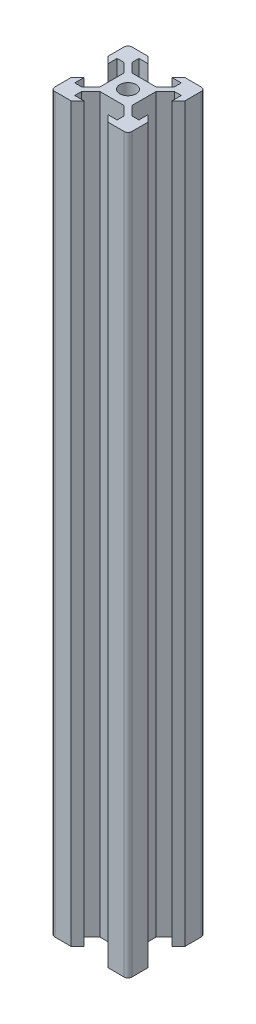
from build123d import *

# Parameters (mm, degrees)
MASTERLAYOUTSKETCH_R = 2.1
MAIN_EXTRUSION_DEPTH = 190
EDGE_FILLETS_R       = 1


with BuildPart() as part:
    # MasterLayoutSketch → Main Extrusion (new body)
    with BuildSketch(Plane(origin=(0, 0, 0), x_dir=(1, 0, 0), z_dir=(0, 1, 0))):
        Polygon((-8.325, 3.1), (-8.325, 5.5), (-6.560660172, 5.5), (-4.160660172, 3.1), (-4.160660172, -3.1), (-6.560660172, -5.5), (-8.325, -5.5), (-8.325, -3.1), (-10, -4.775), (-10, -10), (-4.775, -10), (-3.1, -8.325), (-5.5, -8.325), (-5.5, -6.560660172), (-3.1, -4.160660172), (3.1, -4.160660172), (5.5, -6.560660172), (5.5, -8.325), (3.1, -8.325), (4.775, -10), (10, -10), (10, -4.775), (8.325, -3.1), (8.325, -5.5), (6.560660172, -5.5), (4.160660172, -3.1), (4.160660172, 3.1), (6.560660172, 5.5), (8.325, 5.5), (8.325, 3.1), (10, 4.775), (10, 10), (4.775, 10), (3.1, 8.325), (5.5, 8.325), (5.5, 6.560660172), (3.1, 4.160660172), (-3.1, 4.160660172), (-5.5, 6.560660172), (-5.5, 8.325), (-3.1, 8.325), (-4.775, 10), (-10, 10), (-10, 4.775), align=None)
        with Locations(Location((0, 0, 0), (0, 0, 270))):
            Circle(MASTERLAYOUTSKETCH_R, mode=Mode.SUBTRACT)
    extrude(amount=MAIN_EXTRUSION_DEPTH)

    # Edge Fillets
    edge_fillets_edges = [part.edges().sort_by_distance(p)[0] for p in [
        (10, 95, -10),
        (10, 95, 10),
        (-10, 95, 10),
        (-10, 95, -10),
    ]]
    fillet(edge_fillets_edges, radius=EDGE_FILLETS_R)


solid = part.part
